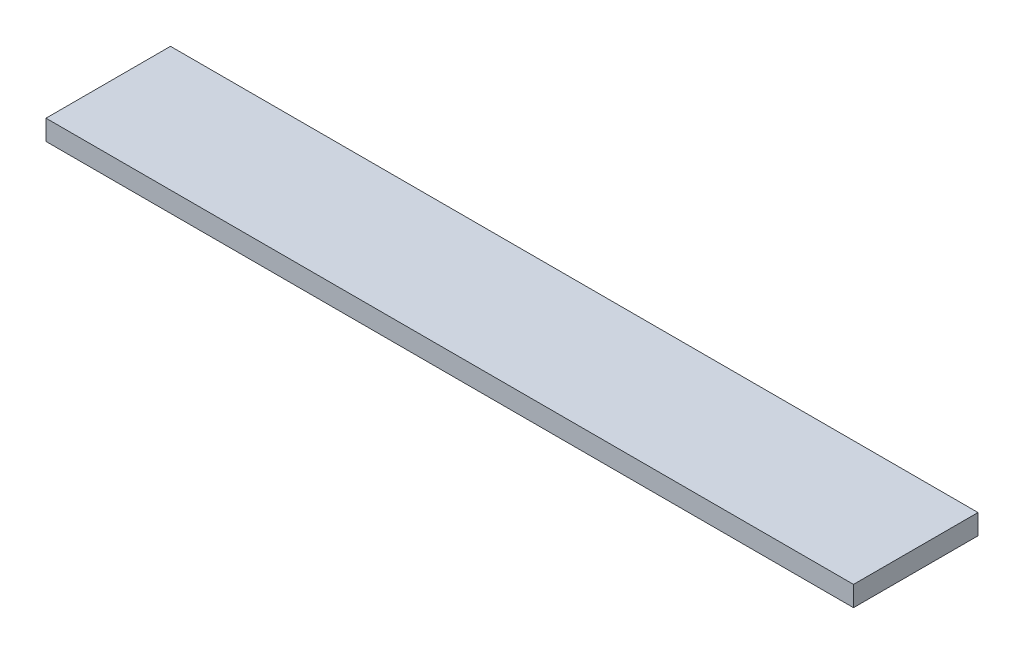
from build123d import *

# Parameters (mm, degrees)
SKETCH1_W           = 1524
SKETCH1_H           = 234.95
BOSS_EXTRUDE1_DEPTH = 38.1


with BuildPart() as part:
    # Sketch1 → Boss-Extrude1 (new body)
    with BuildSketch(Plane(origin=(0, 0, 0), x_dir=(1, 0, 0), z_dir=(0, 1, 0))):
        with Locations((-5943.6, 7593.965)):
            Rectangle(SKETCH1_W, SKETCH1_H)
    extrude(amount=BOSS_EXTRUDE1_DEPTH)


solid = part.part
